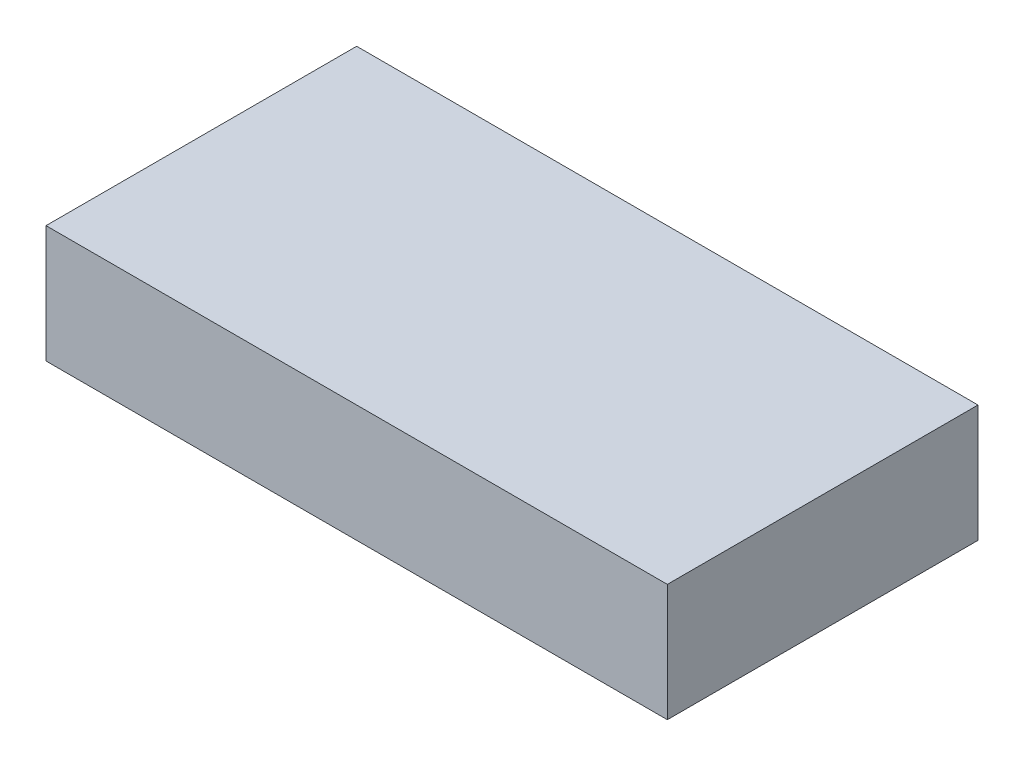
from build123d import *

# Parameters (mm, degrees)
SKETCH1_W           = 15.9
SKETCH1_H           = 7.95
BOSS_EXTRUDE1_DEPTH = 3
SKETCH2_W           = 12.9
SKETCH2_H           = 4.95
CUT_EXTRUDE1_DEPTH  = 2


with BuildPart() as part:
    # Sketch1 → Boss-Extrude1 (new body)
    with BuildSketch(Plane(origin=(0, 0, 0), x_dir=(1, 0, 0), z_dir=(0, 1, 0))):
        with Locations((7.95, -3.975)):
            Rectangle(SKETCH1_W, SKETCH1_H)
    extrude(amount=BOSS_EXTRUDE1_DEPTH)

    # Sketch2 → Cut-Extrude1 (cut)
    with BuildSketch(Plane.XZ):
        with Locations((7.95, 3.975)):
            Rectangle(SKETCH2_W, SKETCH2_H)
    extrude(amount=-CUT_EXTRUDE1_DEPTH, mode=Mode.SUBTRACT)


solid = part.part
